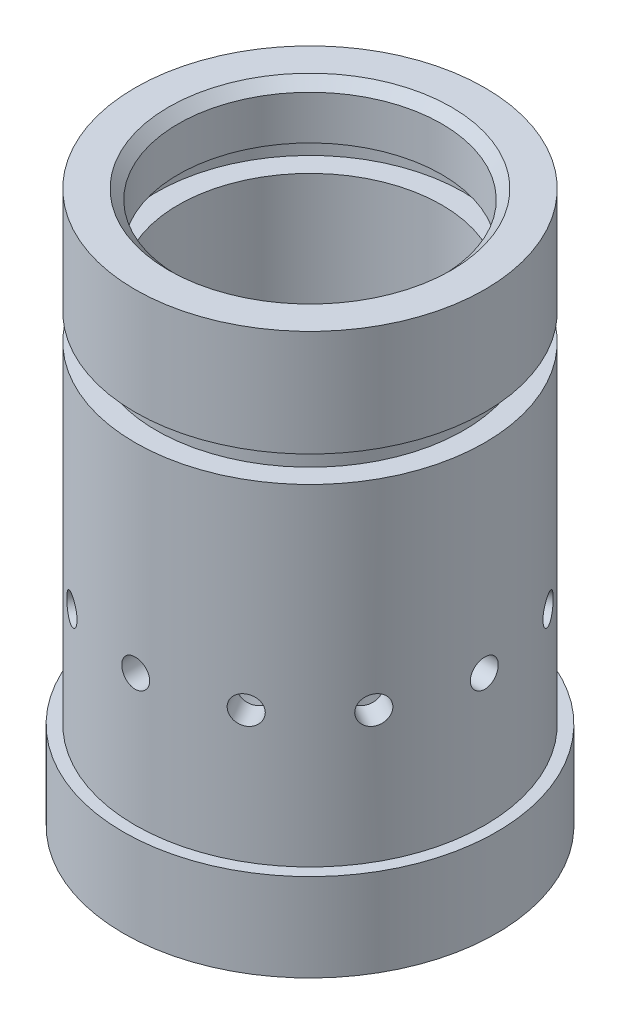
from build123d import *

# Parameters (mm, degrees)
CIRPATTERN1_COUNT = 12


with BuildPart() as part:
    # Sketch1 → Revolve1 (revolve)
    with BuildSketch(Plane.XY, mode=Mode.PRIVATE) as revolve1_sk:
        Polygon((19.05, -29.351053449), (19.05, -60.847053449), (25.2857, -60.847053449), (25.2857, -36.971053449), (22.225, -36.971053449), (22.225, -33.161053449), (25.2857, -33.161053449), (25.2857, -17.794053449), (20.447, -17.794053449), (19.05, -19.191053449), (19.05, -25.541053449), (22.225, -25.541053449), (22.225, -29.351053449), align=None)
        Polygon((25.2857, -84.879763523), (26.9875, -84.879763523), (26.9875, -97.579763523), (25.7175, -97.579763523), (15.875, -60.847053449), (19.05, -60.847053449), (25.2857, -60.847053449), align=None)
    revolve(revolve1_sk.sketch.rotate(Axis((0, 0, 0), (0, 1, 0)), 90), axis=Axis((0, 0, 0), (0, 1, 0)))

    # Sketch3 → #10-32 Tapped Hole1 (revolve, cut)
    with BuildSketch(Plane(origin=(0, -65.829763523, -25.2857), x_dir=(0, 1, 0), z_dir=(1, 0, 0))):
        Polygon((0, 0), (0, 4.166057072), (2.0193, 3.81), (2.0193, 0), align=None)
    f_10_32_tapped_hole1 = revolve(axis=Axis((0, -65.829763523, -31.6357), (0, 0, 1)), mode=Mode.SUBTRACT)

    # CirPattern1: #10-32 Tapped Hole1 ×12 about axis
    cirpattern1_axis = Axis((0, 0, 0), (0, -1, 0))
    for i in range(1, CIRPATTERN1_COUNT):
        add(f_10_32_tapped_hole1.rotate(cirpattern1_axis, i * 360 / CIRPATTERN1_COUNT), mode=Mode.SUBTRACT)


solid = part.part
